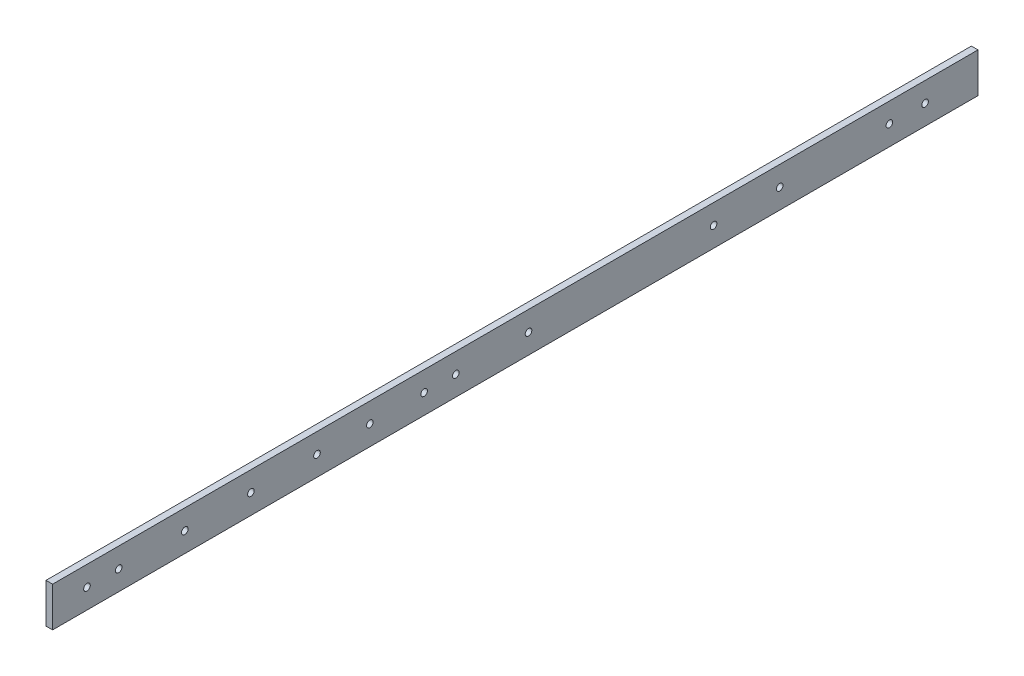
from build123d import *

# Parameters (mm, degrees)
SKETCH1_W           = 5
SKETCH1_H           = 30
BOSS_EXTRUDE1_DEPTH = 700
SKETCH2_R           = 2.5
CUT_EXTRUDE1_DEPTH  = 701.660402763


with BuildPart() as part:
    # Sketch1 → Boss-Extrude1 (new body)
    with BuildSketch(Plane.XY):
        with Locations((2.5, 15)):
            Rectangle(SKETCH1_W, SKETCH1_H)
    extrude(amount=BOSS_EXTRUDE1_DEPTH)

    # Sketch2 → Cut-Extrude1 (cut, through all)
    with BuildSketch(Plane(origin=(5, 0, 0), x_dir=(0, 0, -1), z_dir=(1, 0, 0))):
        with Locations((-674, 15)):
            Circle(SKETCH2_R)
        with Locations((-600, 15)):
            Circle(SKETCH2_R)
        with Locations((-500, 15)):
            Circle(SKETCH2_R)
        with Locations((-550, 15)):
            Circle(SKETCH2_R)
        with Locations((-460, 15)):
            Circle(SKETCH2_R)
        with Locations((-419, 15)):
            Circle(SKETCH2_R)
        with Locations((-395, 15)):
            Circle(SKETCH2_R)
        with Locations((-340, 15)):
            Circle(SKETCH2_R)
        with Locations((-200, 15)):
            Circle(SKETCH2_R)
        with Locations((-650, 15)):
            Circle(SKETCH2_R)
        with Locations((-150, 15)):
            Circle(SKETCH2_R)
        with Locations((-67, 15)):
            Circle(SKETCH2_R)
        with Locations((-40, 15)):
            Circle(SKETCH2_R)
    extrude(amount=-CUT_EXTRUDE1_DEPTH, mode=Mode.SUBTRACT)


solid = part.part
